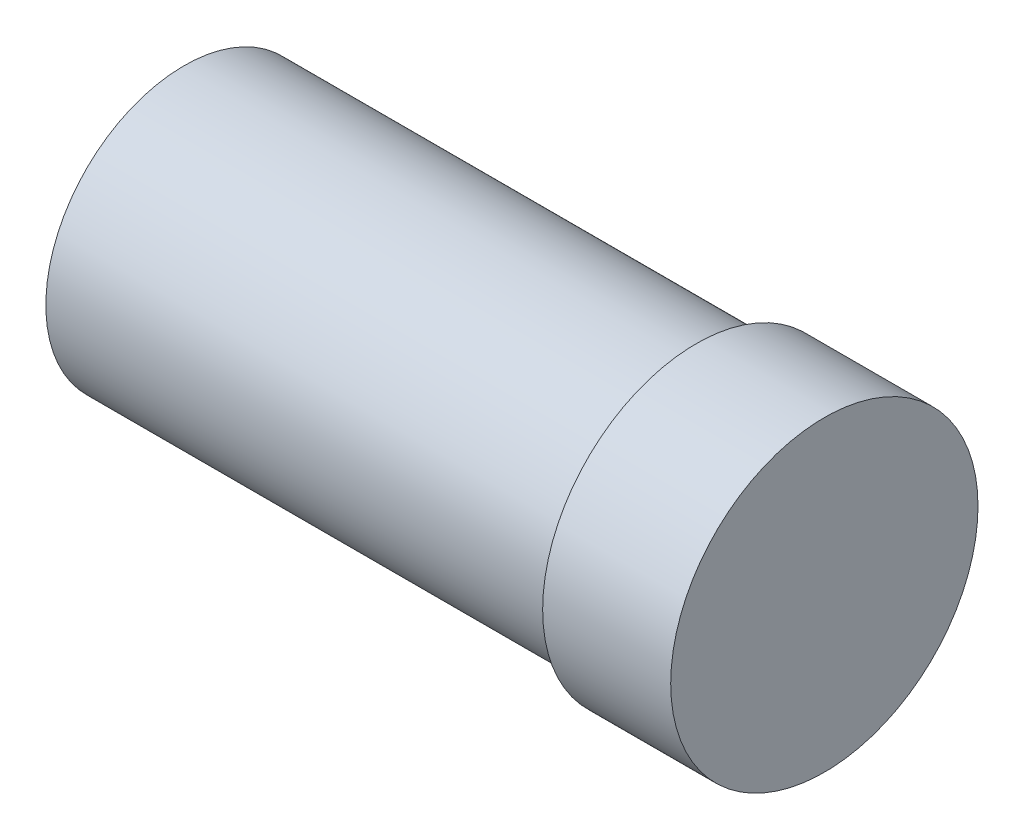
from build123d import *

# Parameters (mm, degrees)
SKETCH2_R           = 27
BOSS_EXTRUDE1_DEPTH = 100
SKETCH3_R           = 30
BOSS_EXTRUDE2_DEPTH = 25


with BuildPart() as part:
    # Sketch2 → Boss-Extrude1 (new body)
    with BuildSketch(Plane(origin=(0, 0, 0), x_dir=(0, 0, -1), z_dir=(1, 0, 0))):
        Circle(SKETCH2_R)
    extrude(amount=BOSS_EXTRUDE1_DEPTH)

    # Sketch3 → Boss-Extrude2 (add)
    with BuildSketch(Plane(origin=(100, 0, 0), x_dir=(0, 0, -1), z_dir=(1, 0, 0))):
        Circle(SKETCH3_R)
    extrude(amount=BOSS_EXTRUDE2_DEPTH)


solid = part.part
